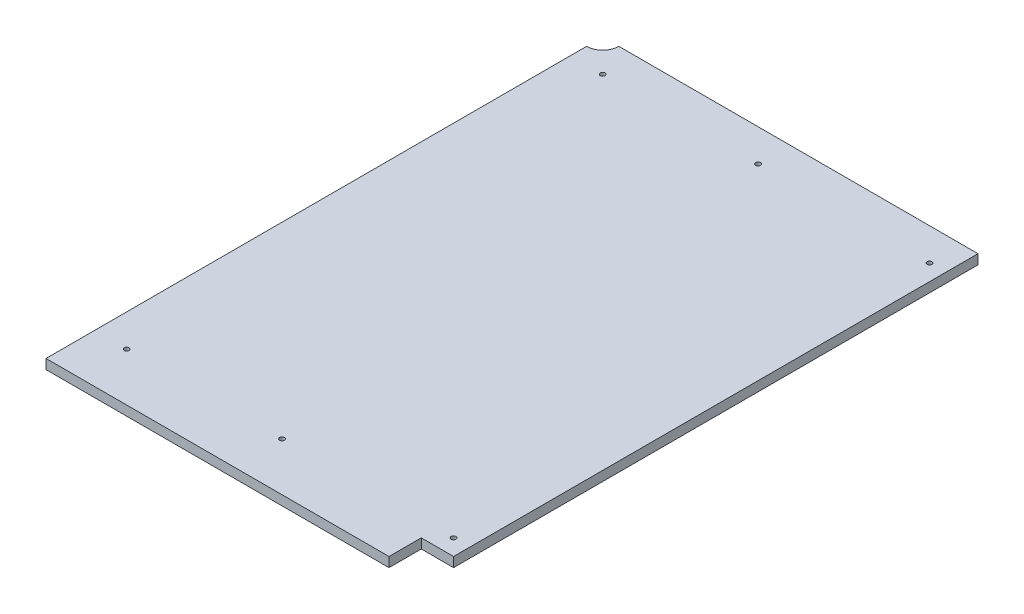
from build123d import *

# Parameters (mm, degrees)
SKETCH_1_R      = 1.5
EXTRUDE_1_DEPTH = 6


with BuildPart() as part:
    # 草图1 → 凸台-拉伸1 (new body)
    with BuildSketch(Plane(origin=(0, 0, 0), x_dir=(1, 0, 0), z_dir=(0, 1, 0))):
        with BuildLine():
            Line((-102.725, 113.5), (119.825, 113.5))
            Line((119.825, 113.5), (119.825, -211.5))
            Line((119.825, -211.5), (99.825, -211.5))
            Line((99.825, -211.5), (99.825, -231.5))
            Line((99.825, -231.5), (-102.725, -231.5))
            Line((-102.725, -231.5), (-112.725, -231.5))
            Line((-112.725, -231.5), (-112.725, -221.5))
            Line((-112.725, -221.5), (-112.725, 103.5))
            ThreePointArc((-112.725, 103.5), (-105.653932188, 106.428932188), (-102.725, 113.5))
        make_face()
        with Locations(Location((-92.725, 93.5, 0), (0, 0, 270))):
            Circle(SKETCH_1_R, mode=Mode.SUBTRACT)
        with Locations(Location((109.825, 93.5, 0), (0, 0, 270))):
            Circle(SKETCH_1_R, mode=Mode.SUBTRACT)
        with Locations(Location((3.55, 93.5, 0), (0, 0, 270))):
            Circle(SKETCH_1_R, mode=Mode.SUBTRACT)
        with Locations(Location((-92.725, -201.5, 0), (0, 0, 270))):
            Circle(SKETCH_1_R, mode=Mode.SUBTRACT)
        with Locations(Location((3.55, -201.5, 0), (0, 0, 270))):
            Circle(SKETCH_1_R, mode=Mode.SUBTRACT)
        with Locations(Location((109.825, -201.5, 0), (0, 0, 270))):
            Circle(SKETCH_1_R, mode=Mode.SUBTRACT)
    extrude(amount=EXTRUDE_1_DEPTH)


solid = part.part
